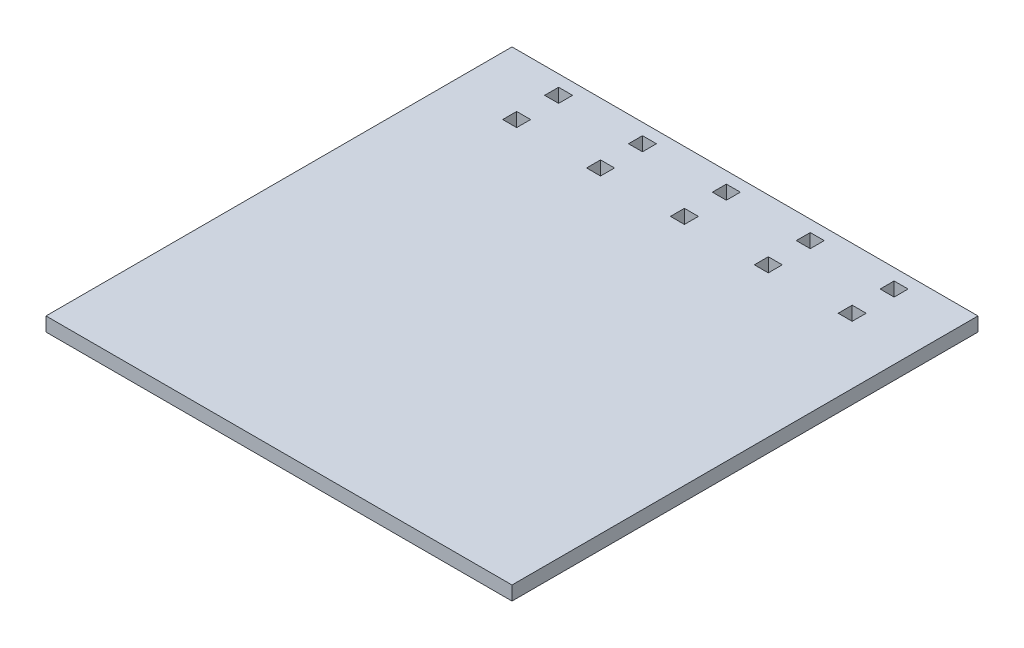
from build123d import *

# Parameters (mm, degrees)
SKETCH2_W           = 200
SKETCH2_H           = 200
SKETCH2_W_2         = 6
SKETCH2_H_2         = 6
BOSS_EXTRUDE1_DEPTH = 6


with BuildPart() as part:
    # Sketch2 → Boss-Extrude1 (new body)
    with BuildSketch(Plane(origin=(0, 0, 0), x_dir=(1, 0, 0), z_dir=(0, 1, 0))):
        with Locations((-100, 100)):
            Rectangle(SKETCH2_W, SKETCH2_H)
        with Locations((-28, 192)):
            Rectangle(SKETCH2_W_2, SKETCH2_H_2, mode=Mode.SUBTRACT)
        with Locations((-28, 174)):
            Rectangle(SKETCH2_W_2, SKETCH2_H_2, mode=Mode.SUBTRACT)
        with Locations((-64, 192)):
            Rectangle(SKETCH2_W_2, SKETCH2_H_2, mode=Mode.SUBTRACT)
        with Locations((-64, 174)):
            Rectangle(SKETCH2_W_2, SKETCH2_H_2, mode=Mode.SUBTRACT)
        with Locations((-100, 192)):
            Rectangle(SKETCH2_W_2, SKETCH2_H_2, mode=Mode.SUBTRACT)
        with Locations((-100, 174)):
            Rectangle(SKETCH2_W_2, SKETCH2_H_2, mode=Mode.SUBTRACT)
        with Locations((-136, 192)):
            Rectangle(SKETCH2_W_2, SKETCH2_H_2, mode=Mode.SUBTRACT)
        with Locations((-136, 174)):
            Rectangle(SKETCH2_W_2, SKETCH2_H_2, mode=Mode.SUBTRACT)
        with Locations((-172, 192)):
            Rectangle(SKETCH2_W_2, SKETCH2_H_2, mode=Mode.SUBTRACT)
        with Locations((-172, 174)):
            Rectangle(SKETCH2_W_2, SKETCH2_H_2, mode=Mode.SUBTRACT)
    extrude(amount=BOSS_EXTRUDE1_DEPTH)


solid = part.part
